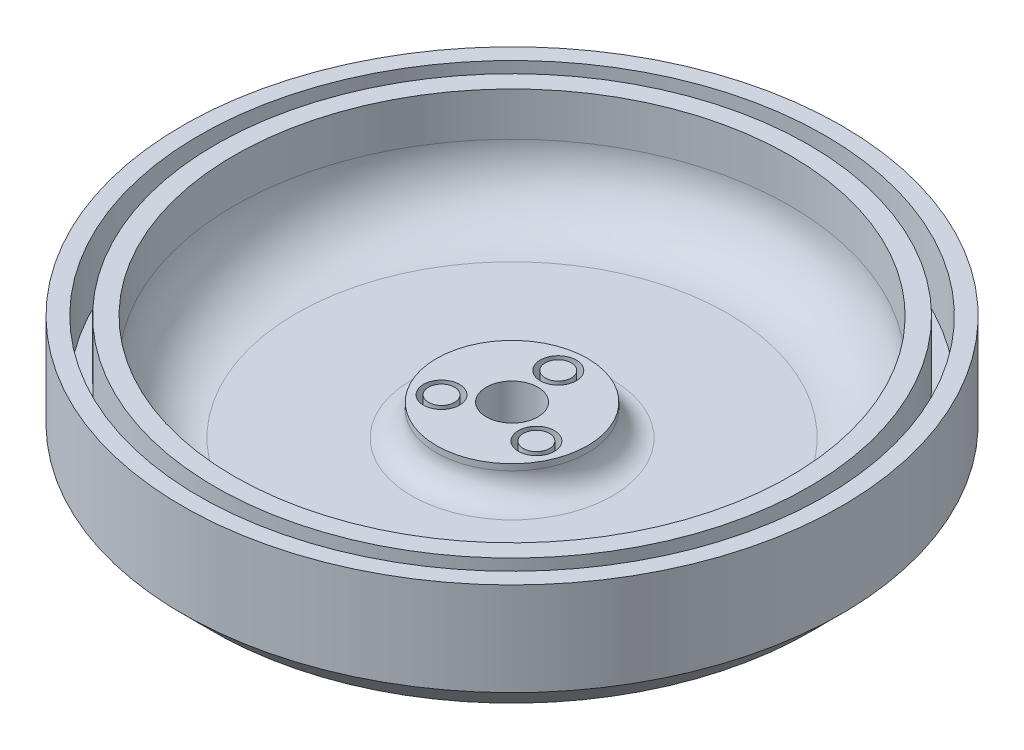
from build123d import *

# Parameters (mm, degrees)
SKETCH3_R           = 23.00375504
CUT_EXTRUDE3_DEPTH  = 14.574115143
SKETCH4_R           = 12.15
SKETCH4_R_2         = 2.9
SKETCH4_R_3         = 4.15
SKETCH4_R_4         = 2.1
BOSS_EXTRUDE1_DEPTH = 5
FILLET1_R           = 4


with BuildPart() as part:
    # Sketch1 → Revolve1 (revolve)
    with BuildSketch(Plane.XY, mode=Mode.PRIVATE) as revolve1_sk:
        with BuildLine():
            Line((-50.3, 10), (-50.3, -0.3))
            Line((-50.3, -0.3), (-47.7, -0.3))
            Line((-47.7, -0.3), (-47.7, 10))
            Line((-47.7, 10), (-44.7, 10))
            Line((-44.7, 10), (-44.7, 3))
            ThreePointArc((-44.7, 3), (-41.771067812, -4.071067812), (-34.7, -7))
            Line((-34.7, -7), (-17.15, -7))
            ThreePointArc((-17.15, -7), (-10.078932188, -4.071067812), (-7.15, 3))
            Line((-7.15, 3), (-7.15, 7.574115143))
            Line((-7.15, 7.574115143), (-4.15, 7.574115143))
            Line((-4.15, 7.574115143), (-4.15, -10))
            Line((-4.15, -10), (-48, -10))
            Line((-48, -10), (-53, -5))
            Line((-53, -5), (-53, 10))
            Line((-53, 10), (-50.3, 10))
        make_face()
    revolve(revolve1_sk.sketch.rotate(Axis((0, 0, 0), (0, 1, 0)), 270), axis=Axis((0, 0, 0), (0, 1, 0)))

    # Sketch3 → Cut-Extrude3 (cut)
    with BuildSketch(Plane(origin=(0, 7.574115143, 0), x_dir=(1, 0, 0), z_dir=(0, 1, 0))):
        Circle(SKETCH3_R)
    extrude(amount=-CUT_EXTRUDE3_DEPTH, mode=Mode.SUBTRACT)

    # Sketch4 → Boss-Extrude1 (add)
    # profile 1 of 4: a face of its own
    with BuildSketch(Plane(origin=(0, -7, 0), x_dir=(1, 0, 0), z_dir=(0, 1, 0))):
        with Locations(Location((0, 0, 0), (0, 0, 90))):
            Circle(SKETCH4_R)
        with Locations(Location((7.377762048, -3.462820695, 0), (0, 0, 270))):
            Circle(SKETCH4_R_2, mode=Mode.SUBTRACT)
        with Locations(Location((-0.689990334, 8.120739704, 0), (0, 0, 270))):
            Circle(SKETCH4_R_2, mode=Mode.SUBTRACT)
        with Locations(Location((-6.687771714, -4.657919009, 0), (0, 0, 270))):
            Circle(SKETCH4_R_2, mode=Mode.SUBTRACT)
        with Locations(Location((0, 0, 0), (0, 0, 90))):
            Circle(SKETCH4_R_3, mode=Mode.SUBTRACT)
    # profile 2 of 4: a face of its own
    with BuildSketch(Plane(origin=(0, -7, 0), x_dir=(1, 0, 0), z_dir=(0, 1, 0))):
        with Locations(Location((-6.687771714, -4.657919009, 0), (0, 0, 90))):
            Circle(SKETCH4_R_4)
    # profile 3 of 4: a face of its own
    with BuildSketch(Plane(origin=(0, -7, 0), x_dir=(1, 0, 0), z_dir=(0, 1, 0))):
        with Locations(Location((7.377762048, -3.462820695, 0), (0, 0, 90))):
            Circle(SKETCH4_R_4)
    # profile 4 of 4: a face of its own
    with BuildSketch(Plane(origin=(0, -7, 0), x_dir=(1, 0, 0), z_dir=(0, 1, 0))):
        with Locations(Location((-0.689990334, 8.120739704, 0), (0, 0, 90))):
            Circle(SKETCH4_R_4)
    extrude(amount=BOSS_EXTRUDE1_DEPTH)

    # Fillet1
    fillet1_edges = [part.edges().sort_by_distance(p)[0] for p in [
        (0, -7, 12.15),
    ]]
    fillet(fillet1_edges, radius=FILLET1_R)


solid = part.part
